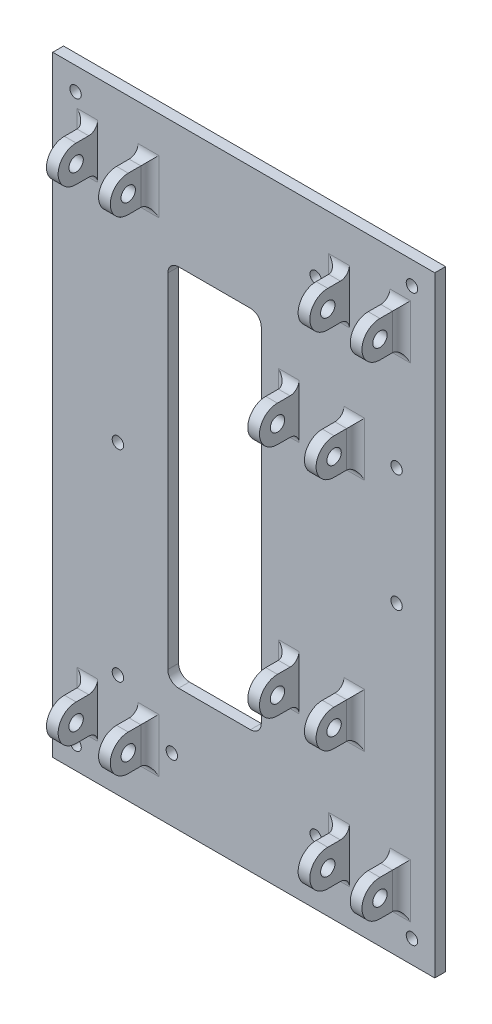
from build123d import *

# Parameters (mm, degrees)
SKETCH1_W               = 212.5
SKETCH1_H               = 339.725
BOSS_EXTRUDE1_DEPTH     = 6
SKETCH2_W               = 6.5
SKETCH2_H               = 20
BOSS_EXTRUDE2_DEPTH     = 24
CUT_EXTRUDE1_DEPTH      = 393.36344838
CUT_EXTRUDE1_DEPTH_BACK = 393.36344838
SKETCH3_R               = 4
FILLET2_R               = 5
SKETCH5_R               = 3.175
CUT_EXTRUDE2_DEPTH      = 402.314497153
CUT_EXTRUDE3_DEPTH      = 402.314497153


with BuildPart() as part:
    # Sketch1 → Boss-Extrude1 (new body)
    with BuildSketch(Plane.XY):
        with Locations((106.25, -169.8625)):
            Rectangle(SKETCH1_W, SKETCH1_H)
    extrude(amount=BOSS_EXTRUDE1_DEPTH)

    # Sketch2 → Boss-Extrude2 (add)
    with BuildSketch(Plane.XY.offset(6)):
        with Locations((21.75, -35.2425)):
            Rectangle(SKETCH2_W, SKETCH2_H)
        with Locations((50.75, -35.2425)):
            Rectangle(SKETCH2_W, SKETCH2_H)
        with Locations((190.75, -35.2425)):
            Rectangle(SKETCH2_W, SKETCH2_H)
        with Locations((161.75, -35.2425)):
            Rectangle(SKETCH2_W, SKETCH2_H)
        with Locations((133.75, -104.5325)):
            Rectangle(SKETCH2_W, SKETCH2_H)
        with Locations((165.25, -104.5325)):
            Rectangle(SKETCH2_W, SKETCH2_H)
        with Locations((165.25, -235.1925)):
            Rectangle(SKETCH2_W, SKETCH2_H)
        with Locations((21.75, -304.4825)):
            Rectangle(SKETCH2_W, SKETCH2_H)
        with Locations((50.75, -304.4825)):
            Rectangle(SKETCH2_W, SKETCH2_H)
        with Locations((190.75, -304.4825)):
            Rectangle(SKETCH2_W, SKETCH2_H)
        with Locations((161.75, -304.4825)):
            Rectangle(SKETCH2_W, SKETCH2_H)
        with Locations((133.75, -235.1925)):
            Rectangle(SKETCH2_W, SKETCH2_H)
    extrude(amount=BOSS_EXTRUDE2_DEPTH)

    # Sketch3 → Cut-Extrude1 (cut, two sides: drawn at the far end of the back side and taken through both)
    with BuildSketch(Plane.ZY.offset(-18.5).offset(-CUT_EXTRUDE1_DEPTH_BACK)):
        with Locations(Location((18, -35.2425, 0), (0, 0, 180))):
            Circle(SKETCH3_R)
        with Locations((18, -235.1925)):
            Circle(SKETCH3_R)
        with Locations(Location((18, -304.4825, 0), (0, 0, 270))):
            Circle(SKETCH3_R)
        with Locations(Location((18, -104.5325, 0), (0, 0, 180))):
            Circle(SKETCH3_R)
        with BuildLine():
            Line((18, -25.2425), (18, -12.982943413))
            Line((18, -12.982943413), (51.949532367, -12.982943413))
            Line((51.949532367, -12.982943413), (51.949532367, -57.481006387))
            Line((51.949532367, -57.481006387), (18, -57.481006387))
            Line((18, -57.481006387), (18, -45.2425))
            ThreePointArc((18, -45.2425), (28, -35.2425), (18, -25.2425))
        make_face()
        with BuildLine():
            Line((52.442304634, -132.399123951), (18, -132.399123951))
            Line((18, -132.399123951), (18, -114.5325))
            ThreePointArc((18, -114.5325), (28, -104.5325), (18, -94.5325))
            Line((18, -94.5325), (18, -71.59149594))
            Line((18, -71.59149594), (52.442304634, -71.59149594))
            Line((52.442304634, -71.59149594), (52.442304634, -132.399123951))
        make_face()
        with BuildLine():
            Line((52.599532243, -270.375386727), (18, -270.375386727))
            Line((18, -270.375386727), (18, -245.1925))
            ThreePointArc((18, -245.1925), (28, -235.1925), (18, -225.1925))
            Line((18, -225.1925), (18, -207.306351849))
            Line((18, -207.306351849), (52.599532243, -207.306351849))
            Line((52.599532243, -207.306351849), (52.599532243, -270.375386727))
        make_face()
        with BuildLine():
            Line((52.621034016, -326.721115515), (18, -326.721115515))
            Line((18, -326.721115515), (18, -314.4825))
            ThreePointArc((18, -314.4825), (28, -304.4825), (18, -294.4825))
            Line((18, -294.4825), (18, -282.222834285))
            Line((18, -282.222834285), (52.621034016, -282.222834285))
            Line((52.621034016, -282.222834285), (52.621034016, -326.721115515))
        make_face()
    extrude(amount=CUT_EXTRUDE1_DEPTH + CUT_EXTRUDE1_DEPTH_BACK, mode=Mode.SUBTRACT)

    # Fillet2
    fillet2_edges = [part.edges().sort_by_distance(p)[0] for p in [
        (190.75, -45.2425, 6),
        (194, -35.2425, 6),
        (190.75, -25.2425, 6),
        (50.75, -45.2425, 6),
        (54, -35.2425, 6),
        (50.75, -25.2425, 6),
        (21.75, -25.2425, 6),
        (18.5, -35.2425, 6),
        (21.75, -45.2425, 6),
        (161.75, -25.2425, 6),
        (158.5, -35.2425, 6),
        (161.75, -45.2425, 6),
        (161.75, -294.4825, 6),
        (161.75, -314.4825, 6),
        (158.5, -304.4825, 6),
        (190.75, -314.4825, 6),
        (194, -304.4825, 6),
        (190.75, -294.4825, 6),
        (165.25, -245.1925, 6),
        (168.5, -235.1925, 6),
        (165.25, -225.1925, 6),
        (133.75, -225.1925, 6),
        (130.5, -235.1925, 6),
        (133.75, -245.1925, 6),
        (50.75, -314.4825, 6),
        (54, -304.4825, 6),
        (50.75, -294.4825, 6),
        (21.75, -294.4825, 6),
        (21.75, -314.4825, 6),
        (18.5, -304.4825, 6),
        (165.25, -114.5325, 6),
        (165.25, -94.5325, 6),
        (168.5, -104.5325, 6),
        (133.75, -94.5325, 6),
        (130.5, -104.5325, 6),
        (133.75, -114.5325, 6),
    ]]
    fillet(fillet2_edges, radius=FILLET2_R)

    # Sketch5 → Cut-Extrude2 (cut, through all)
    with BuildSketch(Plane.XY.offset(6)):
        with Locations((12.7, -12.7)):
            Circle(SKETCH5_R)
        with Locations((199.8, -12.7)):
            Circle(SKETCH5_R)
        with Locations((146.25, -35.2425)):
            Circle(SKETCH5_R)
        with Locations((176.25, -57.8625)):
            Circle(SKETCH5_R)
        with Locations((36.25, -57.8625)):
            Circle(SKETCH5_R)
        with Locations((191.25, -104.5325)):
            Circle(SKETCH5_R)
        with Locations((36.25, -169.8625)):
            Circle(SKETCH5_R)
        with Locations((191.25, -169.8625)):
            Circle(SKETCH5_R)
        with Locations((36.25, -281.8625)):
            Circle(SKETCH5_R)
        with Locations((66.25, -304.4825)):
            Circle(SKETCH5_R)
        with Locations((12.7, -327.025)):
            Circle(SKETCH5_R)
        with Locations((199.8, -327.025)):
            Circle(SKETCH5_R)
        with Locations((146.25, -304.4825)):
            Circle(SKETCH5_R)
    extrude(amount=-CUT_EXTRUDE2_DEPTH, mode=Mode.SUBTRACT)

    # Sketch9 → Cut-Extrude3 (cut, through all)
    with BuildSketch(Plane.XY.offset(6)):
        with BuildLine():
            Line((70, -271.3625), (110, -271.3625))
            ThreePointArc((110, -271.3625), (114.242640687, -269.605140687), (116, -265.3625))
            Line((116, -265.3625), (116, -74.3625))
            ThreePointArc((116, -74.3625), (114.242640687, -70.119859313), (110, -68.3625))
            Line((110, -68.3625), (70, -68.3625))
            ThreePointArc((70, -68.3625), (65.757359313, -70.119859313), (64, -74.3625))
            Line((64, -74.3625), (64, -265.3625))
            ThreePointArc((64, -265.3625), (65.757359313, -269.605140687), (70, -271.3625))
        make_face()
    extrude(amount=-CUT_EXTRUDE3_DEPTH, mode=Mode.SUBTRACT)


solid = part.part
